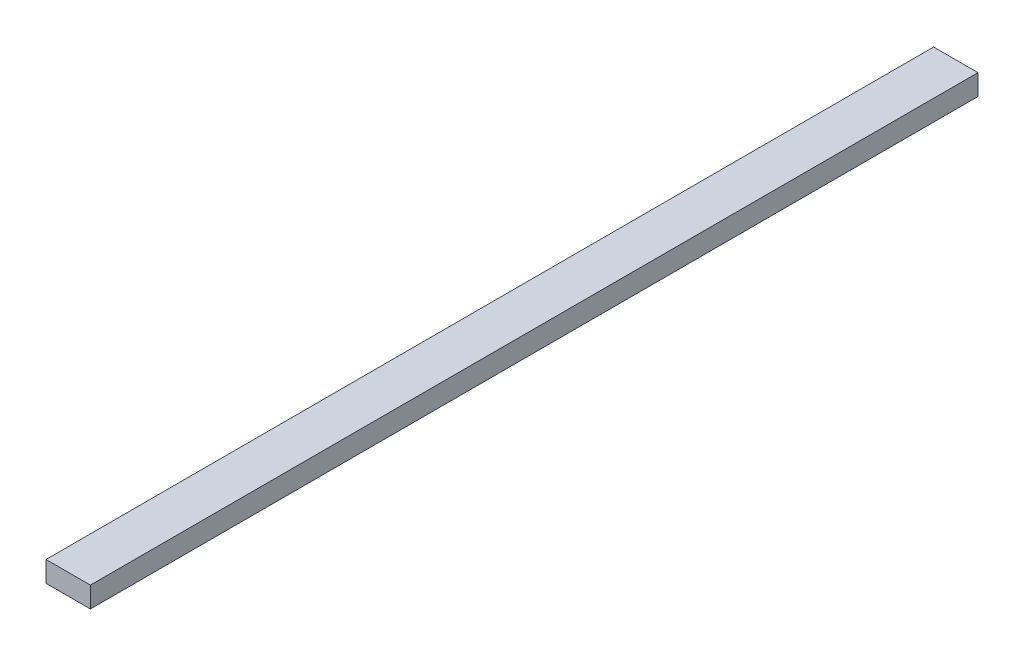
from build123d import *

# Parameters (mm, degrees)
SKETCH_1_W      = 15
SKETCH_1_H      = 7
EXTRUDE_1_DEPTH = 300


with BuildPart() as part:
    # 草图1 → 凸台-拉伸1 (new body)
    with BuildSketch(Plane.XY):
        with Locations((7.5, 3.5)):
            Rectangle(SKETCH_1_W, SKETCH_1_H)
    extrude(amount=EXTRUDE_1_DEPTH)


solid = part.part
